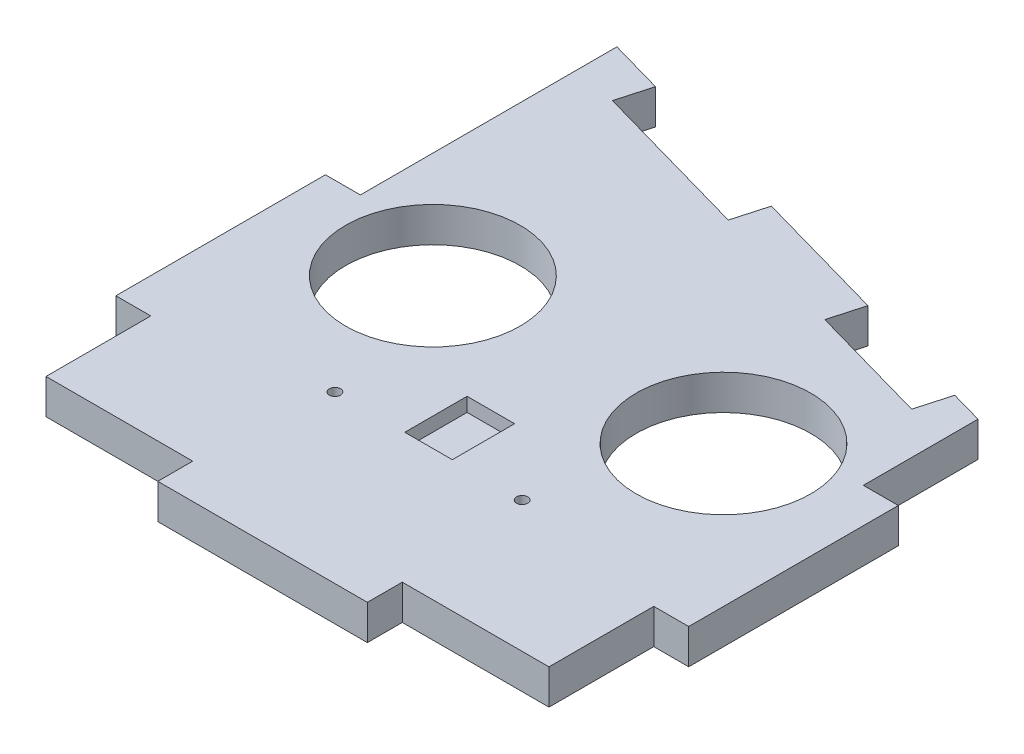
from build123d import *

# Parameters (mm, degrees)
SKETCH1_R           = 7.9375
BOSS_EXTRUDE1_DEPTH = 3.175
SKETCH2_W           = 4.318
SKETCH2_H           = 5.6642
CUT_EXTRUDE1_DEPTH  = 1.27
SKETCH3_R           = 0.508
CUT_EXTRUDE2_DEPTH  = 74.581244154


with BuildPart() as part:
    # Sketch1 → Boss-Extrude1 (new body)
    with BuildSketch(Plane(origin=(0, 0, 0), x_dir=(1, 0, 0), z_dir=(0, 1, 0))):
        Polygon((16.51, 0), (3.175, 0), (3.175, 9.525), (0, 9.525), (0, 28.575), (3.175, 28.575), (3.175, 51.892523221), (8.067183099, 50.512514038), (7.205202957, 47.456762864), (21.872808591, 43.319258185), (22.734788732, 46.375009359), (34.957793427, 42.927088793), (34.095813286, 39.871337619), (45.096517511, 36.768209109), (45.958497653, 39.823960283), (48.895, 38.995618391), (48.895, 28.575), (52.07, 28.575), (52.07, 9.525), (48.895, 9.525), (48.895, 0), (35.56, 0), (35.56, -3.175), (16.51, -3.175), align=None)
        with Locations(Location((12.827, 25.512426191, 0), (0, 0, 270))):
            Circle(SKETCH1_R, mode=Mode.SUBTRACT)
        with Locations(Location((39.243, 25.512426191, 0), (0, 0, 270))):
            Circle(SKETCH1_R, mode=Mode.SUBTRACT)
    extrude(amount=BOSS_EXTRUDE1_DEPTH)

    # Sketch2 → Cut-Extrude1 (cut)
    with BuildSketch(Plane(origin=(0, 3.175, 0), x_dir=(1, 0, 0), z_dir=(0, 1, 0))):
        with Locations((26.035, 14.742826191)):
            Rectangle(SKETCH2_W, SKETCH2_H)
    extrude(amount=-CUT_EXTRUDE1_DEPTH, mode=Mode.SUBTRACT)

    # Sketch3 → Cut-Extrude2 (cut, through all)
    with BuildSketch(Plane(origin=(0, 3.175, 0), x_dir=(1, 0, 0), z_dir=(0, 1, 0))):
        with Locations(Location((17.526, 11.910726191, 0), (0, 0, 270))):
            Circle(SKETCH3_R)
        with Locations(Location((34.544, 11.910726191, 0), (0, 0, 270))):
            Circle(SKETCH3_R)
    extrude(amount=-CUT_EXTRUDE2_DEPTH, mode=Mode.SUBTRACT)


solid = part.part
